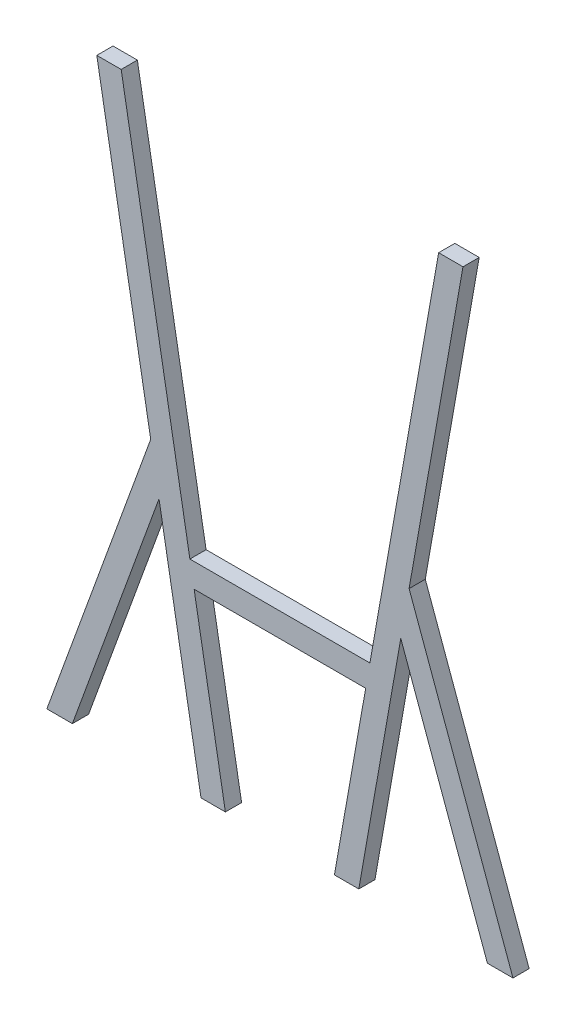
from build123d import *

# Parameters (mm, degrees)
BOSS_EXTRU_1_DEPTH = 27
BOSS_EXTRU_2_DEPTH = 27


with BuildPart() as part:
    # Esquisse1 → Boss.-Extru.1 (new body)
    with BuildSketch(Plane.XY):
        Polygon((0, 0), (-173.648177667, 984.807753012), (-133.031113192, 984.807753012), (-18.530468053, 335.442325904), (281.469531947, 335.442325904), (395.970177086, 984.807753012), (436.587241561, 984.807753012), (262.939063894, 0), (222.321999419, 0), (274.416452719, 295.442325904), (-11.477388825, 295.442325904), (40.617064475, 0), align=None)
    extrude(amount=BOSS_EXTRU_1_DEPTH)

    # Esquisse2 → Boss.-Extru.2 (add)
    with BuildSketch(Plane.XY.offset(27)):
        Polygon((-69.948886071, 396.699845877), (-214.335821908, 0), (-256.902932807, 0), (-83.840740284, 475.484466118), align=None)
        Polygon((346.779804178, 475.484466118), (332.887949965, 396.699845877), (477.274885802, 0), (519.841996701, 0), align=None)
    extrude(amount=-BOSS_EXTRU_2_DEPTH)


solid = part.part
